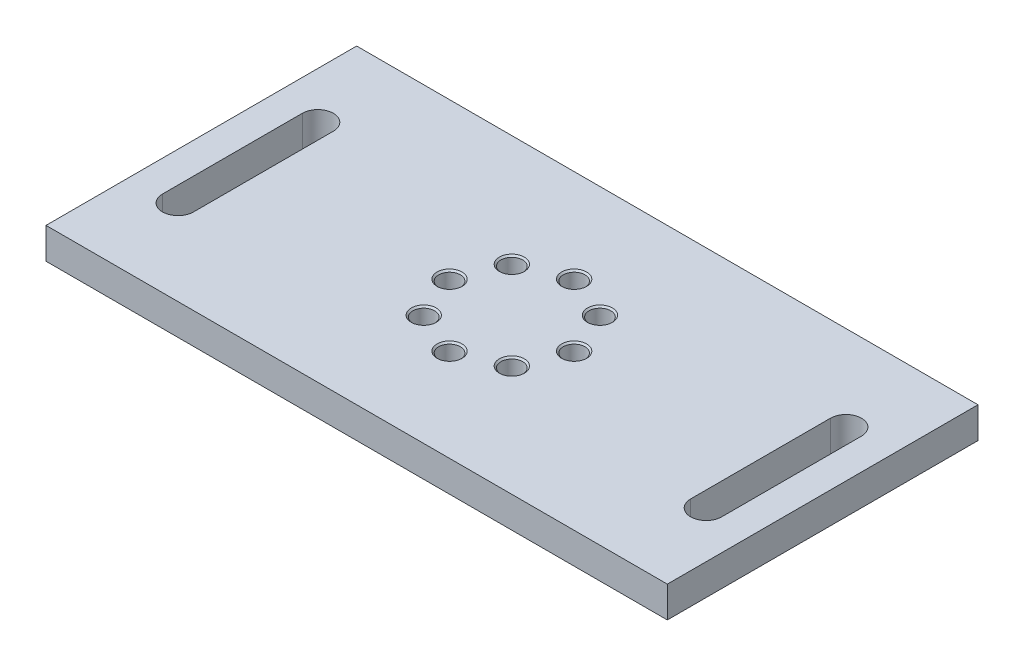
from build123d import *

# Parameters (mm, degrees)
SKETCH2_W                       = 200
SKETCH2_H                       = 100
BOSS_EXTRUDE2_DEPTH             = 10
M8X1_0_TAPPED_HOLE1_D           = 7
M8X1_0_TAPPED_HOLE1_CSINK_D     = 8.05
M8X1_0_TAPPED_HOLE1_CSINK_ANGLE = 90
CIRPATTERN1_COUNT               = 8
CUT_EXTRUDE1_DEPTH              = 224.830292856


with BuildPart() as part:
    # Sketch2 → Boss-Extrude2 (new body)
    with BuildSketch(Plane(origin=(0, 0, 0), x_dir=(1, 0, 0), z_dir=(0, 1, 0))):
        with Locations((100, 50)):
            Rectangle(SKETCH2_W, SKETCH2_H)
    extrude(amount=BOSS_EXTRUDE2_DEPTH)

    # M8x1.0 Tapped Hole1 (through all)
    with Locations(Plane(origin=(0, 10, 0), x_dir=(1, 0, 0), z_dir=(0, 1, 0))):
        with Locations((100, 70)):
            m8x1_0_tapped_hole1 = CounterSinkHole(M8X1_0_TAPPED_HOLE1_D / 2, M8X1_0_TAPPED_HOLE1_CSINK_D / 2, counter_sink_angle=M8X1_0_TAPPED_HOLE1_CSINK_ANGLE)

    # CirPattern1: M8x1.0 Tapped Hole1 ×8 about axis
    cirpattern1_axis = Axis((100, 0, -49.948974386), (0, 1, 0))
    for i in range(1, CIRPATTERN1_COUNT):
        add(m8x1_0_tapped_hole1.rotate(cirpattern1_axis, i * 360 / CIRPATTERN1_COUNT), mode=Mode.SUBTRACT)

    # Sketch6 → Cut-Extrude1 (cut, through all)
    with BuildSketch(Plane(origin=(0, 10, 0), x_dir=(1, 0, 0), z_dir=(0, 1, 0))):
        with BuildLine():
            Line((20, 72.5), (20, 27.5))
            ThreePointArc((20, 27.5), (15, 22.5), (10, 27.5))
            Line((10, 27.5), (10, 72.5))
            ThreePointArc((10, 72.5), (15, 77.5), (20, 72.5))
        make_face()
        with BuildLine():
            Line((180, 72.5), (180, 27.5))
            ThreePointArc((180, 27.5), (185, 22.5), (190, 27.5))
            Line((190, 27.5), (190, 72.5))
            ThreePointArc((190, 72.5), (185, 77.5), (180, 72.5))
        make_face()
    extrude(amount=-CUT_EXTRUDE1_DEPTH, mode=Mode.SUBTRACT)


solid = part.part
